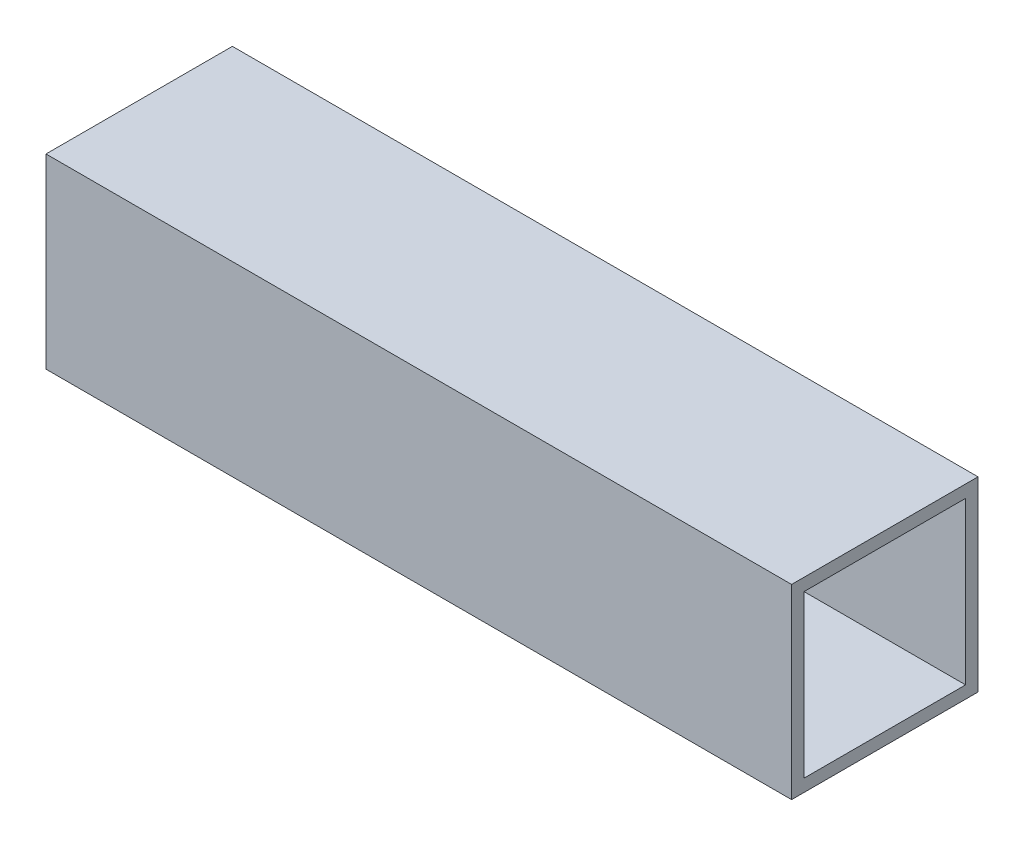
from build123d import *

# Parameters (mm, degrees)
SKETCH_11_W       = 15
SKETCH_11_H       = 15
SKETCH_11_W_2     = 13
SKETCH_11_H_2     = 13
F_15X15X1_1_DEPTH = 60


with BuildPart() as part:
    # 草图11 → 铝管 15X15X1(1) (new body)
    with BuildSketch(Plane(origin=(0, 0, 0), x_dir=(0, -1, 0), z_dir=(-1, 0, 0))):
        Rectangle(SKETCH_11_W, SKETCH_11_H)
        Rectangle(SKETCH_11_W_2, SKETCH_11_H_2, mode=Mode.SUBTRACT)
    extrude(amount=F_15X15X1_1_DEPTH)


solid = part.part
